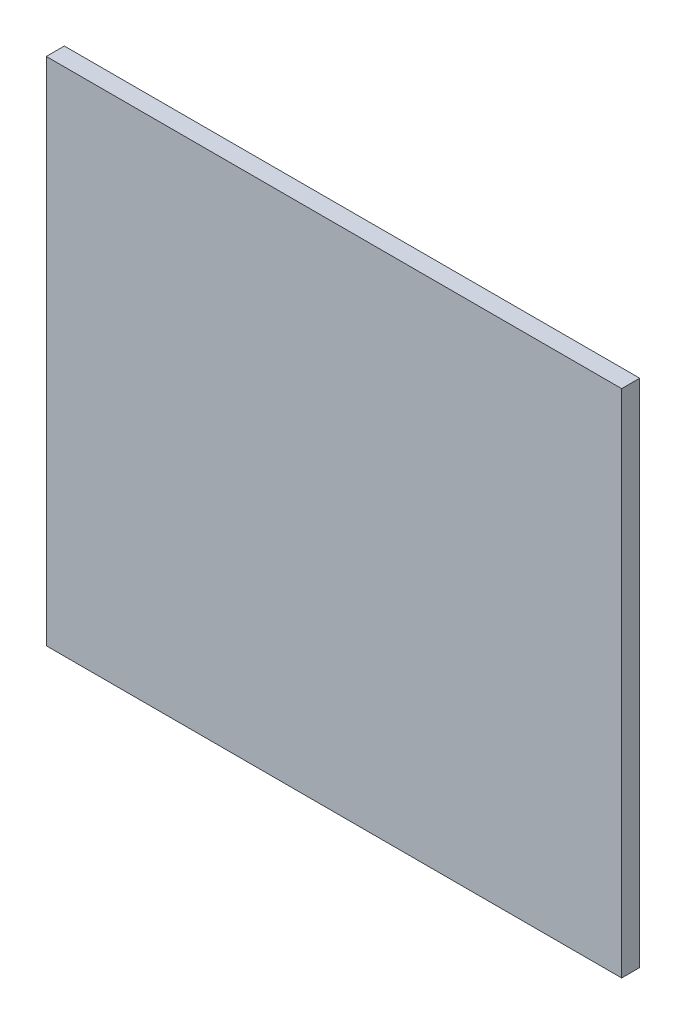
from build123d import *

# Parameters (mm, degrees)
SKETCH_1_W      = 398.5
SKETCH_1_H      = 353.5
EXTRUDE_1_DEPTH = 12.5


with BuildPart() as part:
    # Эскиз1 → Бобышка-Вытянуть1 (new body)
    with BuildSketch(Plane.XY):
        with Locations((-200.75, -176.75)):
            Rectangle(SKETCH_1_W, SKETCH_1_H)
    extrude(amount=-EXTRUDE_1_DEPTH)


solid = part.part
